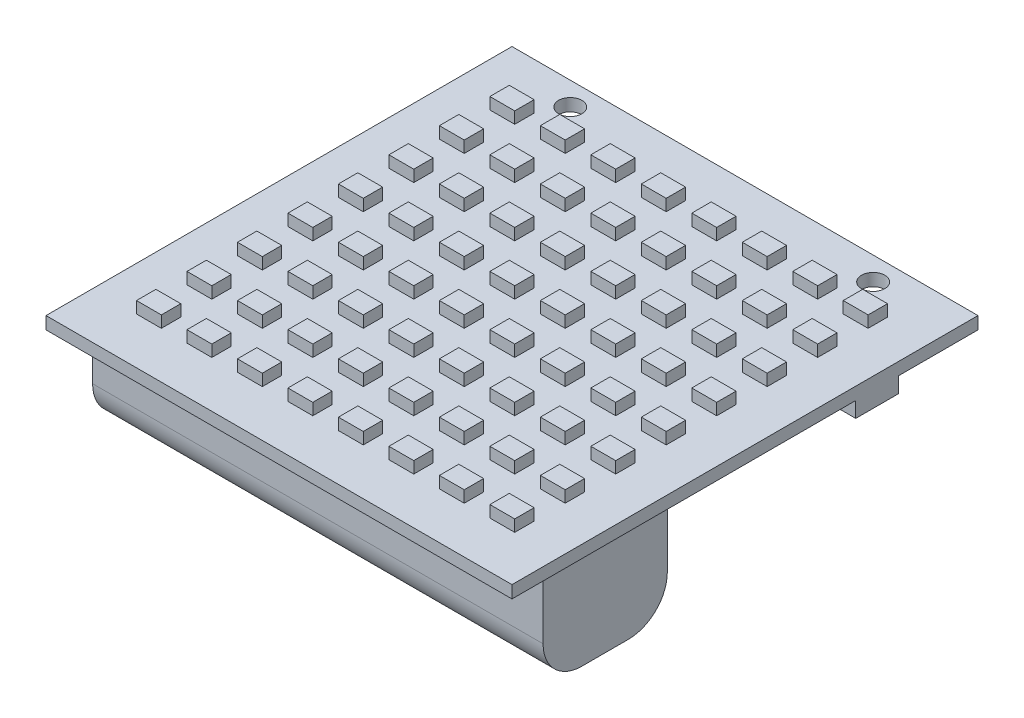
from build123d import *

# Parameters (mm, degrees)
SKETCH1_W           = 60
SKETCH1_H           = 60
BOSS_EXTRUDE1_DEPTH = 1.6
SKETCH2_W           = 3.2
SKETCH2_H           = 2.5
BOSS_EXTRUDE2_DEPTH = 1.5
SKETCH4_W           = 58
SKETCH4_H           = 16
BOSS_EXTRUDE3_DEPTH = 13
FILLET1_R           = 5
CUT_EXTRUDE1_REACH  = 52.138
SKETCH5_R           = 1.5
SKETCH6_W           = 20
SKETCH6_H           = 17
BOSS_EXTRUDE4_DEPTH = 3.2
SKETCH7_W           = 4
SKETCH7_H           = 5.5
BOSS_EXTRUDE5_DEPTH = 2


with BuildPart() as part:
    # Sketch1 → Boss-Extrude1 (new body)
    with BuildSketch(Plane(origin=(0, 0, 0), x_dir=(1, 0, 0), z_dir=(0, 1, 0))):
        with Locations((-5.537137766, -2.214696793)):
            Rectangle(SKETCH1_W, SKETCH1_H)
    extrude(amount=BOSS_EXTRUDE1_DEPTH)

    # Sketch2 → Boss-Extrude2 (add)
    with BuildSketch(Plane(origin=(0, 1.6, 0), x_dir=(1, 0, 0), z_dir=(0, 1, 0))):
        with Locations((-21.787137766, 20.535303207)):
            Rectangle(SKETCH2_W, SKETCH2_H)
        with Locations((-28.287137766, 20.535303207)):
            Rectangle(SKETCH2_W, SKETCH2_H)
        with Locations((-15.287137766, 20.535303207)):
            Rectangle(SKETCH2_W, SKETCH2_H)
        with Locations((-8.787137766, 20.535303207)):
            Rectangle(SKETCH2_W, SKETCH2_H)
        with Locations((-2.287137766, 20.535303207)):
            Rectangle(SKETCH2_W, SKETCH2_H)
        with Locations((4.212862234, 20.535303207)):
            Rectangle(SKETCH2_W, SKETCH2_H)
        with Locations((10.712862234, 20.535303207)):
            Rectangle(SKETCH2_W, SKETCH2_H)
        with Locations((17.212862234, 20.535303207)):
            Rectangle(SKETCH2_W, SKETCH2_H)
        with Locations((-21.787137766, 14.035303207)):
            Rectangle(SKETCH2_W, SKETCH2_H)
        with Locations((-15.287137766, 14.035303207)):
            Rectangle(SKETCH2_W, SKETCH2_H)
        with Locations((-8.787137766, 14.035303207)):
            Rectangle(SKETCH2_W, SKETCH2_H)
        with Locations((-2.287137766, 14.035303207)):
            Rectangle(SKETCH2_W, SKETCH2_H)
        with Locations((4.212862234, 14.035303207)):
            Rectangle(SKETCH2_W, SKETCH2_H)
        with Locations((10.712862234, 14.035303207)):
            Rectangle(SKETCH2_W, SKETCH2_H)
        with Locations((17.212862234, 14.035303207)):
            Rectangle(SKETCH2_W, SKETCH2_H)
        with Locations((-21.787137766, 7.535303207)):
            Rectangle(SKETCH2_W, SKETCH2_H)
        with Locations((-15.287137766, 7.535303207)):
            Rectangle(SKETCH2_W, SKETCH2_H)
        with Locations((-8.787137766, 7.535303207)):
            Rectangle(SKETCH2_W, SKETCH2_H)
        with Locations((-2.287137766, 7.535303207)):
            Rectangle(SKETCH2_W, SKETCH2_H)
        with Locations((4.212862234, 7.535303207)):
            Rectangle(SKETCH2_W, SKETCH2_H)
        with Locations((10.712862234, 7.535303207)):
            Rectangle(SKETCH2_W, SKETCH2_H)
        with Locations((17.212862234, 7.535303207)):
            Rectangle(SKETCH2_W, SKETCH2_H)
        with Locations((-21.787137766, 1.035303207)):
            Rectangle(SKETCH2_W, SKETCH2_H)
        with Locations((-15.287137766, 1.035303207)):
            Rectangle(SKETCH2_W, SKETCH2_H)
        with Locations((-8.787137766, 1.035303207)):
            Rectangle(SKETCH2_W, SKETCH2_H)
        with Locations((-2.287137766, 1.035303207)):
            Rectangle(SKETCH2_W, SKETCH2_H)
        with Locations((4.212862234, 1.035303207)):
            Rectangle(SKETCH2_W, SKETCH2_H)
        with Locations((10.712862234, 1.035303207)):
            Rectangle(SKETCH2_W, SKETCH2_H)
        with Locations((17.212862234, 1.035303207)):
            Rectangle(SKETCH2_W, SKETCH2_H)
        with Locations((-21.787137766, -5.464696793)):
            Rectangle(SKETCH2_W, SKETCH2_H)
        with Locations((-15.287137766, -5.464696793)):
            Rectangle(SKETCH2_W, SKETCH2_H)
        with Locations((-8.787137766, -5.464696793)):
            Rectangle(SKETCH2_W, SKETCH2_H)
        with Locations((-2.287137766, -5.464696793)):
            Rectangle(SKETCH2_W, SKETCH2_H)
        with Locations((4.212862234, -5.464696793)):
            Rectangle(SKETCH2_W, SKETCH2_H)
        with Locations((10.712862234, -5.464696793)):
            Rectangle(SKETCH2_W, SKETCH2_H)
        with Locations((17.212862234, -5.464696793)):
            Rectangle(SKETCH2_W, SKETCH2_H)
        with Locations((-21.787137766, -11.964696793)):
            Rectangle(SKETCH2_W, SKETCH2_H)
        with Locations((-15.287137766, -11.964696793)):
            Rectangle(SKETCH2_W, SKETCH2_H)
        with Locations((-8.787137766, -11.964696793)):
            Rectangle(SKETCH2_W, SKETCH2_H)
        with Locations((-2.287137766, -11.964696793)):
            Rectangle(SKETCH2_W, SKETCH2_H)
        with Locations((4.212862234, -11.964696793)):
            Rectangle(SKETCH2_W, SKETCH2_H)
        with Locations((10.712862234, -11.964696793)):
            Rectangle(SKETCH2_W, SKETCH2_H)
        with Locations((17.212862234, -11.964696793)):
            Rectangle(SKETCH2_W, SKETCH2_H)
        with Locations((-21.787137766, -18.464696793)):
            Rectangle(SKETCH2_W, SKETCH2_H)
        with Locations((-15.287137766, -18.464696793)):
            Rectangle(SKETCH2_W, SKETCH2_H)
        with Locations((-8.787137766, -18.464696793)):
            Rectangle(SKETCH2_W, SKETCH2_H)
        with Locations((-2.287137766, -18.464696793)):
            Rectangle(SKETCH2_W, SKETCH2_H)
        with Locations((4.212862234, -18.464696793)):
            Rectangle(SKETCH2_W, SKETCH2_H)
        with Locations((10.712862234, -18.464696793)):
            Rectangle(SKETCH2_W, SKETCH2_H)
        with Locations((17.212862234, -18.464696793)):
            Rectangle(SKETCH2_W, SKETCH2_H)
        with Locations((-21.787137766, -24.964696793)):
            Rectangle(SKETCH2_W, SKETCH2_H)
        with Locations((-15.287137766, -24.964696793)):
            Rectangle(SKETCH2_W, SKETCH2_H)
        with Locations((-8.787137766, -24.964696793)):
            Rectangle(SKETCH2_W, SKETCH2_H)
        with Locations((-2.287137766, -24.964696793)):
            Rectangle(SKETCH2_W, SKETCH2_H)
        with Locations((4.212862234, -24.964696793)):
            Rectangle(SKETCH2_W, SKETCH2_H)
        with Locations((10.712862234, -24.964696793)):
            Rectangle(SKETCH2_W, SKETCH2_H)
        with Locations((17.212862234, -24.964696793)):
            Rectangle(SKETCH2_W, SKETCH2_H)
        with Locations((-28.287137766, 14.035303207)):
            Rectangle(SKETCH2_W, SKETCH2_H)
        with Locations((-28.287137766, 7.535303207)):
            Rectangle(SKETCH2_W, SKETCH2_H)
        with Locations((-28.287137766, 1.035303207)):
            Rectangle(SKETCH2_W, SKETCH2_H)
        with Locations((-28.287137766, -5.464696793)):
            Rectangle(SKETCH2_W, SKETCH2_H)
        with Locations((-28.287137766, -11.964696793)):
            Rectangle(SKETCH2_W, SKETCH2_H)
        with Locations((-28.287137766, -18.464696793)):
            Rectangle(SKETCH2_W, SKETCH2_H)
        with Locations((-28.287137766, -24.964696793)):
            Rectangle(SKETCH2_W, SKETCH2_H)
    extrude(amount=BOSS_EXTRUDE2_DEPTH)

    # Sketch4 → Boss-Extrude3 (add)
    with BuildSketch(Plane.XZ):
        with Locations((-5.537137766, 19.214696793)):
            Rectangle(SKETCH4_W, SKETCH4_H)
    extrude(amount=BOSS_EXTRUDE3_DEPTH)

    # Fillet1
    fillet1_edges = [part.edges().sort_by_distance(p)[0] for p in [
        (-5.537137766, -13, 27.214696793),
        (-5.537137766, -13, 11.214696793),
    ]]
    fillet(fillet1_edges, radius=FILLET1_R)

    # Sketch5 → Cut-Extrude1 (cut, up to next)
    with BuildSketch(Plane(origin=(0, 1.6, 0), x_dir=(1, 0, 0), z_dir=(0, 1, 0)), mode=Mode.PRIVATE) as cut_extrude1_sk1:
        with Locations(Location((-25.037137766, 24.785303207, 0), (0, 0, 270))):
            Circle(SKETCH5_R)
    cut_extrude1_tool1 = extrude(cut_extrude1_sk1.sketch, amount=-CUT_EXTRUDE1_REACH, mode=Mode.PRIVATE) & part.part
    # Sketch5 → Cut-Extrude1 (cut, up to next)
    with BuildSketch(Plane(origin=(0, 1.6, 0), x_dir=(1, 0, 0), z_dir=(0, 1, 0)), mode=Mode.PRIVATE) as cut_extrude1_sk2:
        with Locations(Location((13.962862234, 24.785303207, 0), (0, 0, 270))):
            Circle(SKETCH5_R)
    cut_extrude1_tool2 = extrude(cut_extrude1_sk2.sketch, amount=-CUT_EXTRUDE1_REACH, mode=Mode.PRIVATE) & part.part
    add(cut_extrude1_tool1.solids().sort_by_distance((-25.037138, 1.6, -24.785303))[0], mode=Mode.SUBTRACT)
    add(cut_extrude1_tool2.solids().sort_by_distance((13.962862, 1.6, -24.785303))[0], mode=Mode.SUBTRACT)

    # Sketch6 → Boss-Extrude4 (add)
    with BuildSketch(Plane.XZ):
        with Locations((-22.884232904, -12.709224584)):
            Rectangle(SKETCH6_W, SKETCH6_H)
    extrude(amount=BOSS_EXTRUDE4_DEPTH)

    # Sketch7 → Boss-Extrude5 (add)
    with BuildSketch(Plane.XZ):
        with Locations((22.462862234, -14.794303796)):
            Rectangle(SKETCH7_W, SKETCH7_H)
    extrude(amount=BOSS_EXTRUDE5_DEPTH)


solid = part.part
